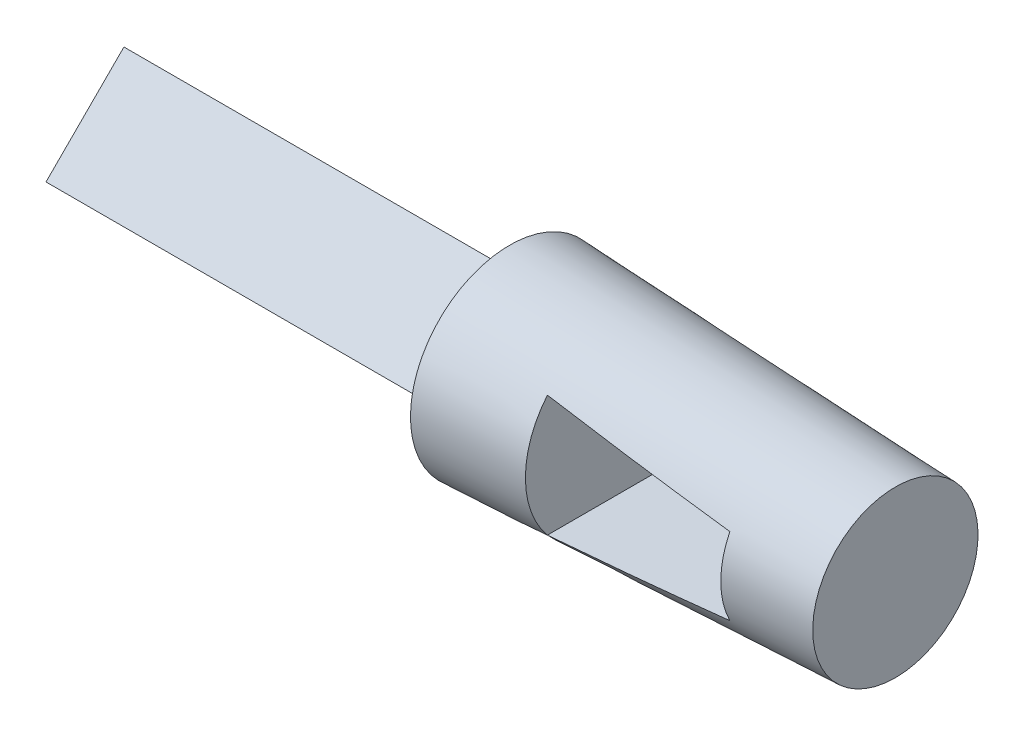
from build123d import *

# Parameters (mm, degrees)
EXTRUDE_1_DEPTH          = 35
CUT_EXTRUDE_1_DEPTH      = 35
CUT_EXTRUDE_1_DEPTH_BACK = 35


with BuildPart() as part:
    # Эскиз1 → Бобышка-Вытянуть1 (new body)
    with BuildSketch(Plane(origin=(0, 0, 0), x_dir=(0, 0, -1), z_dir=(1, 0, 0))):
        Polygon((0, 7.071067812), (7.071067812, 0), (0, -7.071067812), (-7.071067812, 0), align=None)
    extrude(amount=EXTRUDE_1_DEPTH)

    # Эскиз4 → Вырез-Повернуть3 (revolve, cut)
    with BuildSketch(Plane.XY):
        Polygon((0, 0), (13.443375673, 0), (12, 2.5), (0, 2.5), (0, 3.998541838), (-2.044837982, 0), align=None)
    revolve(axis=Axis((13.443375673, 0, 0), (-1, 0, 0)), mode=Mode.SUBTRACT)


with BuildPart() as body_2:
    # Эскиз2 → Повернуть1 (revolve)
    with BuildSketch(Plane.XY):
        Polygon((70, 0), (70, 7.5), (35, 9), (35, 0), align=None)
    revolve(axis=Axis((35, 0, 0), (1, 0, 0)))

    # Эскиз3 → Вырез-Вытянуть1 (cut, two sides: drawn at the far end of the back side and taken through both)
    with BuildSketch(Plane.XY.offset(-CUT_EXTRUDE_1_DEPTH_BACK)):
        Polygon((45, -5.5), (45, 5.5), (62, 3.5), (62, -3.5), align=None)
    extrude(amount=CUT_EXTRUDE_1_DEPTH + CUT_EXTRUDE_1_DEPTH_BACK, mode=Mode.SUBTRACT)


solid = Compound([part.part, body_2.part])
